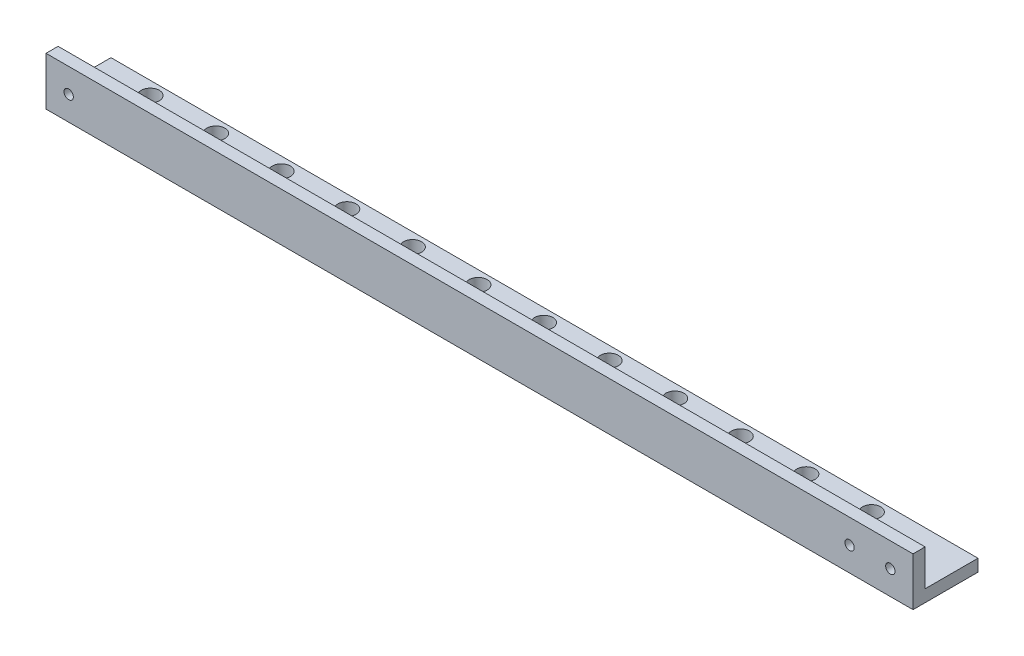
from build123d import *

# Parameters (mm, degrees)
SKETCH1_W           = 286.9
SKETCH1_H           = 21.5
SKETCH1_R           = 3
BOSS_EXTRUDE1_DEPTH = 4
SKETCH2_W           = 286.9
SKETCH2_H           = 12
BOSS_EXTRUDE2_DEPTH = 4
SKETCH6_R           = 1.55
CUT_EXTRUDE4_DEPTH  = 271.248330559


with BuildPart() as part:
    # Sketch1 → Boss-Extrude1 (new body)
    with BuildSketch(Plane(origin=(0, 0, 0), x_dir=(1, 0, 0), z_dir=(0, 1, 0))):
        with Locations((126.1, -6.4)):
            Rectangle(SKETCH1_W, SKETCH1_H)
        with Locations(Location((0, 0, 0), (0, 0, 270))):
            Circle(SKETCH1_R, mode=Mode.SUBTRACT)
        with Locations(Location((21.7, 0, 0), (0, 0, 270))):
            Circle(SKETCH1_R, mode=Mode.SUBTRACT)
        with Locations(Location((43.4, 0, 0), (0, 0, 270))):
            Circle(SKETCH1_R, mode=Mode.SUBTRACT)
        with Locations(Location((65.1, 0, 0), (0, 0, 270))):
            Circle(SKETCH1_R, mode=Mode.SUBTRACT)
        with Locations(Location((86.8, 0, 0), (0, 0, 270))):
            Circle(SKETCH1_R, mode=Mode.SUBTRACT)
        with Locations(Location((108.5, 0, 0), (0, 0, 270))):
            Circle(SKETCH1_R, mode=Mode.SUBTRACT)
        with Locations(Location((130.2, 0, 0), (0, 0, 270))):
            Circle(SKETCH1_R, mode=Mode.SUBTRACT)
        with Locations(Location((151.9, 0, 0), (0, 0, 270))):
            Circle(SKETCH1_R, mode=Mode.SUBTRACT)
        with Locations(Location((173.6, 0, 0), (0, 0, 270))):
            Circle(SKETCH1_R, mode=Mode.SUBTRACT)
        with Locations(Location((195.3, 0, 0), (0, 0, 270))):
            Circle(SKETCH1_R, mode=Mode.SUBTRACT)
        with Locations(Location((217, 0, 0), (0, 0, 270))):
            Circle(SKETCH1_R, mode=Mode.SUBTRACT)
        with Locations(Location((238.7, 0, 0), (0, 0, 270))):
            Circle(SKETCH1_R, mode=Mode.SUBTRACT)
    extrude(amount=BOSS_EXTRUDE1_DEPTH)

    # Sketch2 → Boss-Extrude2 (add)
    with BuildSketch(Plane.XY.offset(17.15)):
        with Locations((126.1, 10)):
            Rectangle(SKETCH2_W, SKETCH2_H)
    extrude(amount=-BOSS_EXTRUDE2_DEPTH)

    # Sketch6 → Cut-Extrude4 (cut, through all)
    with BuildSketch(Plane(origin=(0, 8.408785298, 13.15), x_dir=(-1, 0, 0), z_dir=(0, 0, 1))):
        with Locations(Location((-262.05, 0.408785298, 0), (0, 0, 180))):
            Circle(SKETCH6_R)
        with Locations(Location((-248.55, 0.408785298, 0), (0, 0, 180))):
            Circle(SKETCH6_R)
        with Locations(Location((9.85, 0.408785298, 0), (0, 0, 180))):
            Circle(SKETCH6_R)
    extrude(amount=CUT_EXTRUDE4_DEPTH, mode=Mode.SUBTRACT)


solid = part.part
